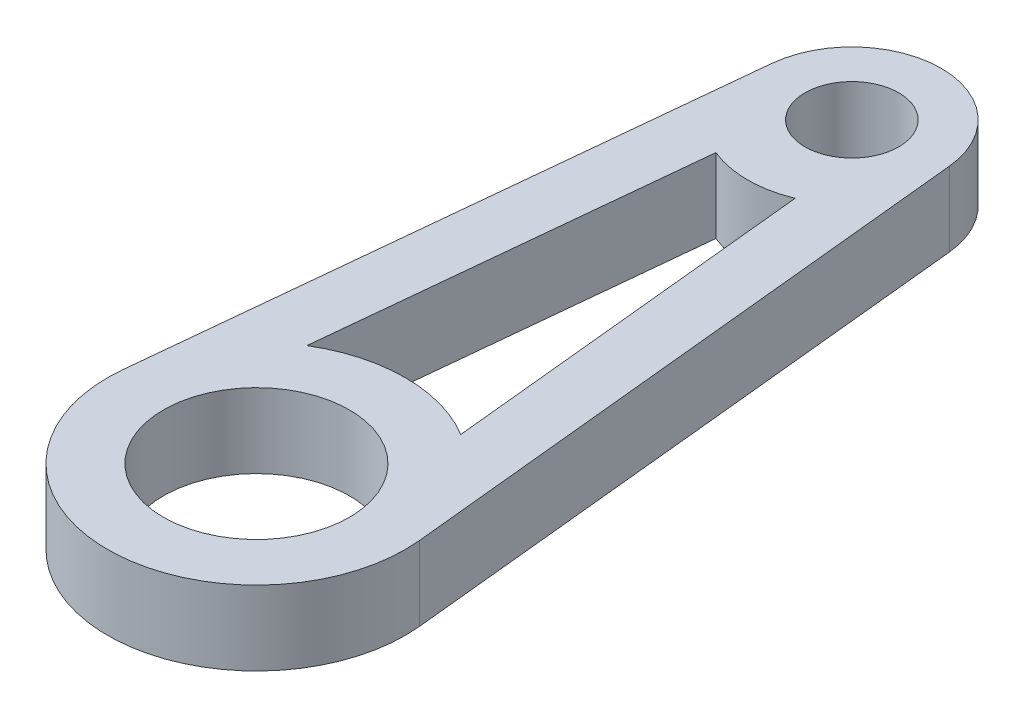
from build123d import *

# Parameters (mm, degrees)
SKETCH1_R           = 2
SKETCH1_R_2         = 3.96875
BOSS_EXTRUDE1_DEPTH = 3.175


with BuildPart() as part:
    # Sketch1 → Boss-Extrude1 (new body)
    with BuildSketch(Plane(origin=(0, 0, 0), x_dir=(1, 0, 0), z_dir=(0, 1, 0))):
        with BuildLine():
            Line((-3.790902135, 0.381), (-6.318170226, -24.765))
            ThreePointArc((-6.318170226, -24.765), (0, -31.75), (6.318170226, -24.765))
            Line((6.318170226, -24.765), (3.790902135, 0.381))
            ThreePointArc((3.790902135, 0.381), (0, 3.81), (-3.790902135, 0.381))
        make_face()
        with Locations(Location((0, 0, 0), (0, 0, 270))):
            Circle(SKETCH1_R, mode=Mode.SUBTRACT)
        with Locations(Location((0, -25.4, 0), (0, 0, 270))):
            Circle(SKETCH1_R_2, mode=Mode.SUBTRACT)
        with BuildLine():
            Line((3.282902135, -19.964463819), (1.689604995, -4.111357435))
            ThreePointArc((1.689604995, -4.111357435), (0, -4.445), (-1.689604995, -4.111357435))
            Line((-1.689604995, -4.111357435), (-3.282902135, -19.964463819))
            ThreePointArc((-3.282902135, -19.964463819), (0, -19.05), (3.282902135, -19.964463819))
        make_face(mode=Mode.SUBTRACT)
    extrude(amount=-BOSS_EXTRUDE1_DEPTH)


solid = part.part
